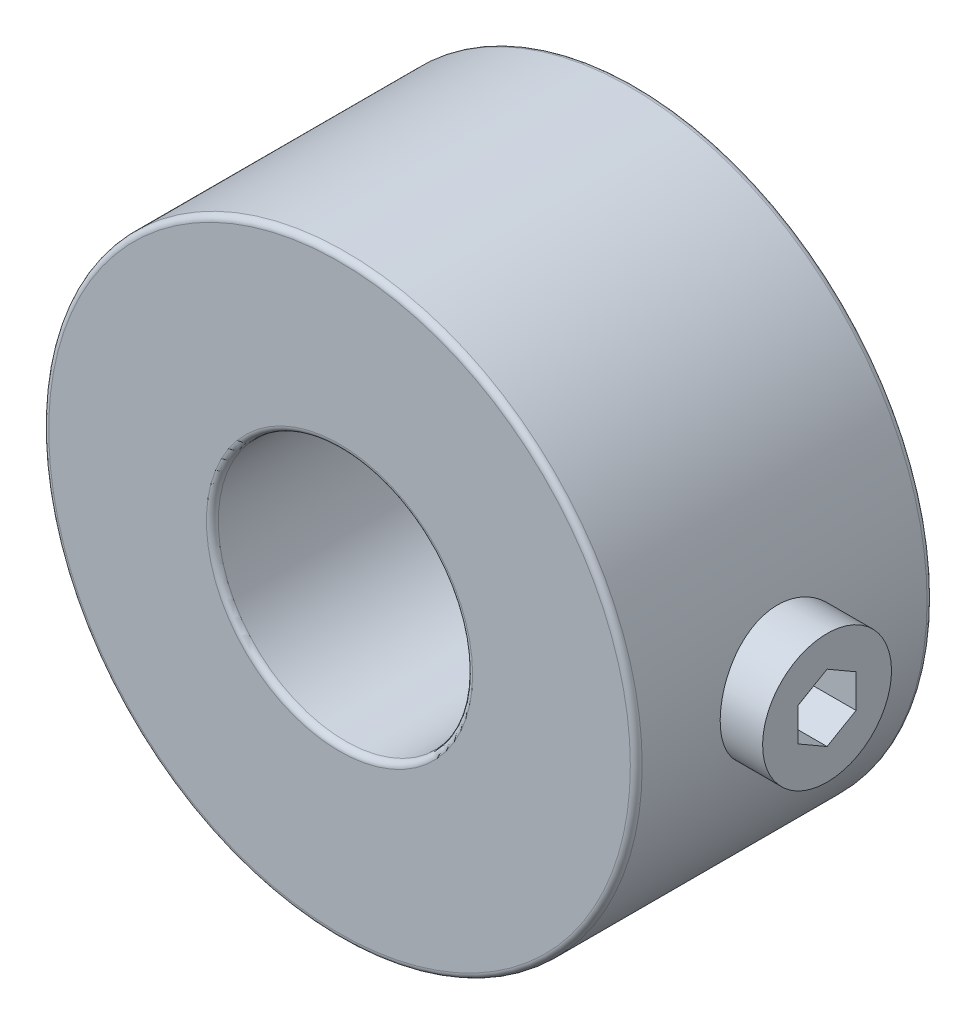
from build123d import *

# Parameters (mm, degrees)
SKETCH1_R               = 11.1125
SKETCH1_R_2             = 4.7625
EXTRUDE1_DEPTH          = 11.1125
CUT_EXTRUDE1_REACH      = 29.22
CUT_EXTRUDE1_END_RADIUS = 4.7625
SKETCH2_R               = 2.413
SKETCH3_W               = 6.35
SKETCH3_H               = 2.413
CUT_EXTRUDE2_DEPTH      = 1.5875
FILLET1_R               = 0.22225


with BuildPart() as part:
    # Sketch1 → Extrude1 (new body)
    with BuildSketch(Plane.XY):
        Circle(SKETCH1_R)
        Circle(SKETCH1_R_2, mode=Mode.SUBTRACT)
    extrude(amount=EXTRUDE1_DEPTH)

    # Cut-Extrude1: up to this cylinder (the profile starts outside it)
    cut_extrude1_end = Plane(origin=(0, 0, 5.55625), z_dir=(0, 0, -1)) * Cylinder(CUT_EXTRUDE1_END_RADIUS, 68.965, mode=Mode.PRIVATE)
    # Sketch2 → Cut-Extrude1 (cut, up to the surface)
    with BuildSketch(Plane(origin=(11.1125, 0, 0), x_dir=(0, 0, -1), z_dir=(1, 0, 0)), mode=Mode.PRIVATE) as cut_extrude1_sk1:
        with Locations((-5.55625, 0)):
            Circle(SKETCH2_R)
    cut_extrude1_tool1 = extrude(cut_extrude1_sk1.sketch, amount=-CUT_EXTRUDE1_REACH, mode=Mode.PRIVATE) - cut_extrude1_end
    add(cut_extrude1_tool1.solids().sort_by_distance((11.1125, 0, 5.55625))[0], mode=Mode.SUBTRACT)

    # Fillet1
    fillet1_edges = [part.edges().sort_by_distance(p)[0] for p in [
        (-11.1125, 0, 0),
        (-11.1125, 0, 11.1125),
        (-4.7625, 0, 0),
        (-4.7625, 0, 11.1125),
    ]]
    fillet(fillet1_edges, radius=FILLET1_R)


with BuildPart() as body_2:
    # Sketch3 → Revolve1 (revolve)
    with BuildSketch(Plane.XY.offset(5.55625), mode=Mode.PRIVATE) as revolve1_sk:
        with Locations((9.525, 1.2065)):
            Rectangle(SKETCH3_W, SKETCH3_H)
    revolve(revolve1_sk.sketch.rotate(Axis((6.35, 0, 5.55625), (1, 0, 0)), 180), axis=Axis((6.35, 0, 5.55625), (1, 0, 0)))

    # Sketch4 → Cut-Extrude2 (cut)
    with BuildSketch(Plane(origin=(12.7, 0, 0), x_dir=(0, 0, -1), z_dir=(1, 0, 0))):
        Polygon((-5.55625, 1.25383158), (-6.6421, 0.62691579), (-6.6421, -0.62691579), (-5.55625, -1.25383158), (-4.4704, -0.62691579), (-4.4704, 0.62691579), align=None)
    extrude(amount=-CUT_EXTRUDE2_DEPTH, mode=Mode.SUBTRACT)


solid = Compound([part.part, body_2.part])
